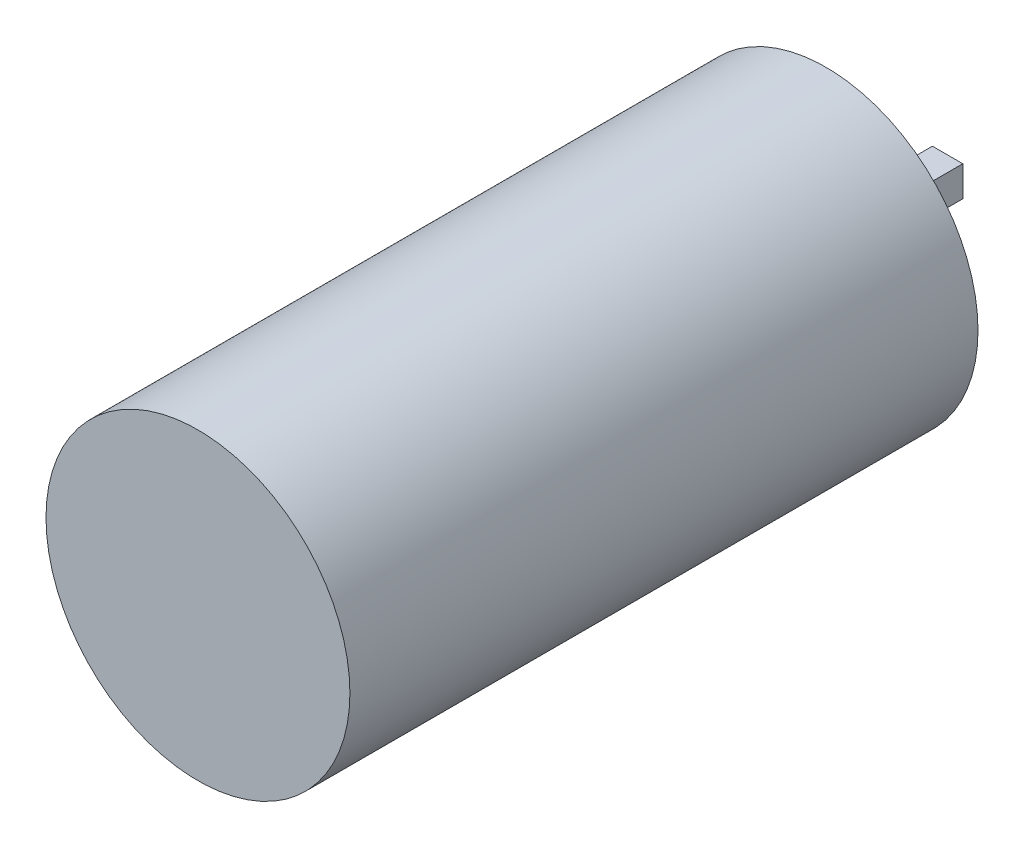
from build123d import *

# Parameters (mm, degrees)
ESQUISSE1_R        = 15
BOSS_EXTRU_1_DEPTH = 62
ESQUISSE2_W        = 3
ESQUISSE2_H        = 3
BOSS_EXTRU_2_DEPTH = 12


with BuildPart() as part:
    # Esquisse1 → Boss.-Extru.1 (new body)
    with BuildSketch(Plane.XY):
        Circle(ESQUISSE1_R)
    extrude(amount=BOSS_EXTRU_1_DEPTH)

    # Esquisse2 → Boss.-Extru.2 (add)
    with BuildSketch(Plane(origin=(0, 0, 0), x_dir=(-1, 0, 0), z_dir=(0, 0, -1))):
        Rectangle(ESQUISSE2_W, ESQUISSE2_H)
    extrude(amount=BOSS_EXTRU_2_DEPTH)


solid = part.part
